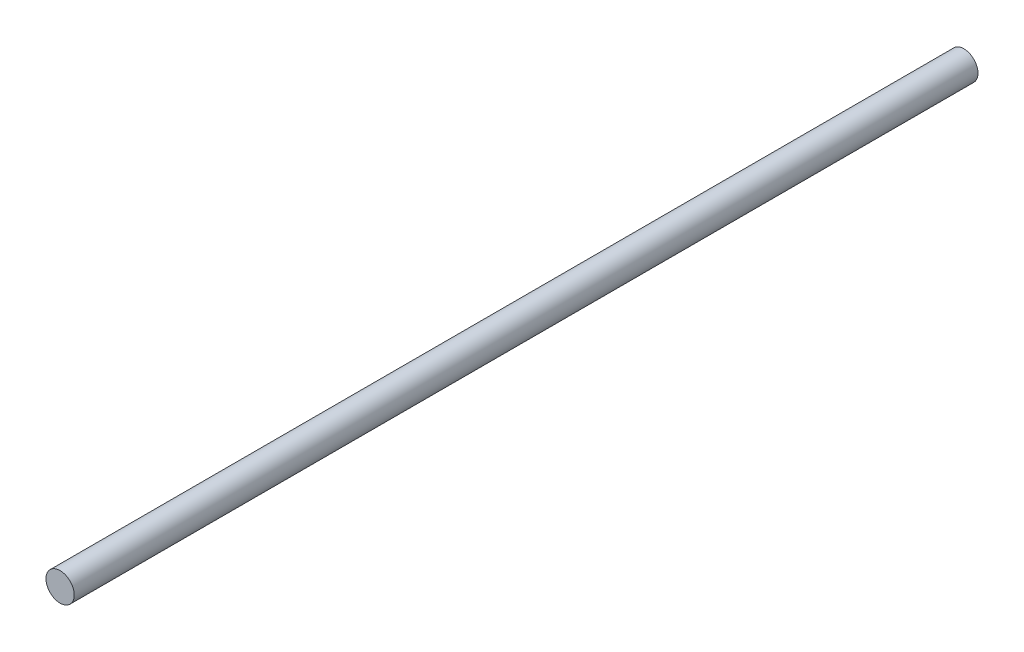
from build123d import *

# Parameters (mm, degrees)
SKETCH1_R           = 3.175
BOSS_EXTRUDE1_DEPTH = 101.6


with BuildPart() as part:
    # Sketch1 → Boss-Extrude1 (new, symmetric)
    with BuildSketch(Plane.XY):
        Circle(SKETCH1_R)
    extrude(amount=BOSS_EXTRUDE1_DEPTH, both=True)


solid = part.part
